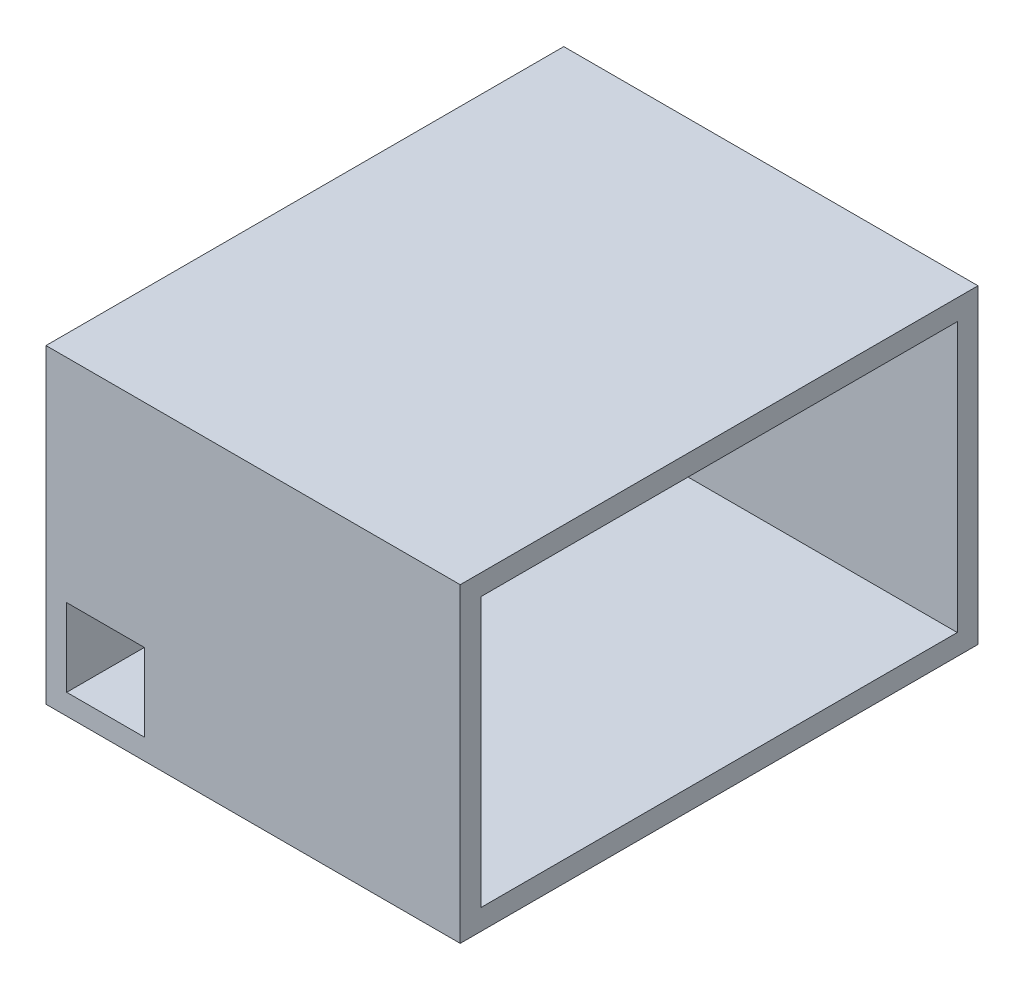
from build123d import *

# Parameters (mm, degrees)
SKETCH1_W           = 80
SKETCH1_H           = 100
BOSS_EXTRUDE1_DEPTH = 60
SKETCH4_W           = 92
SKETCH4_H           = 52
CUT_EXTRUDE1_DEPTH  = 76
SKETCH5_W           = 15
SKETCH5_H           = 15
CUT_EXTRUDE2_DEPTH  = 4


with BuildPart() as part:
    # Sketch1 → Boss-Extrude1 (new body)
    with BuildSketch(Plane(origin=(0, 0, 0), x_dir=(1, 0, 0), z_dir=(0, 1, 0))):
        Rectangle(SKETCH1_W, SKETCH1_H)
    extrude(amount=BOSS_EXTRUDE1_DEPTH)

    # Sketch4 → Cut-Extrude1 (cut)
    with BuildSketch(Plane(origin=(40, 0, 0), x_dir=(0, 0, -1), z_dir=(1, 0, 0))):
        with Locations((0, 30)):
            Rectangle(SKETCH4_W, SKETCH4_H)
    extrude(amount=-CUT_EXTRUDE1_DEPTH, mode=Mode.SUBTRACT)

    # Sketch5 → Cut-Extrude2 (cut)
    with BuildSketch(Plane.XY.offset(50)):
        with Locations((-28.5, 11.5)):
            Rectangle(SKETCH5_W, SKETCH5_H)
    extrude(amount=-CUT_EXTRUDE2_DEPTH, mode=Mode.SUBTRACT)


solid = part.part
